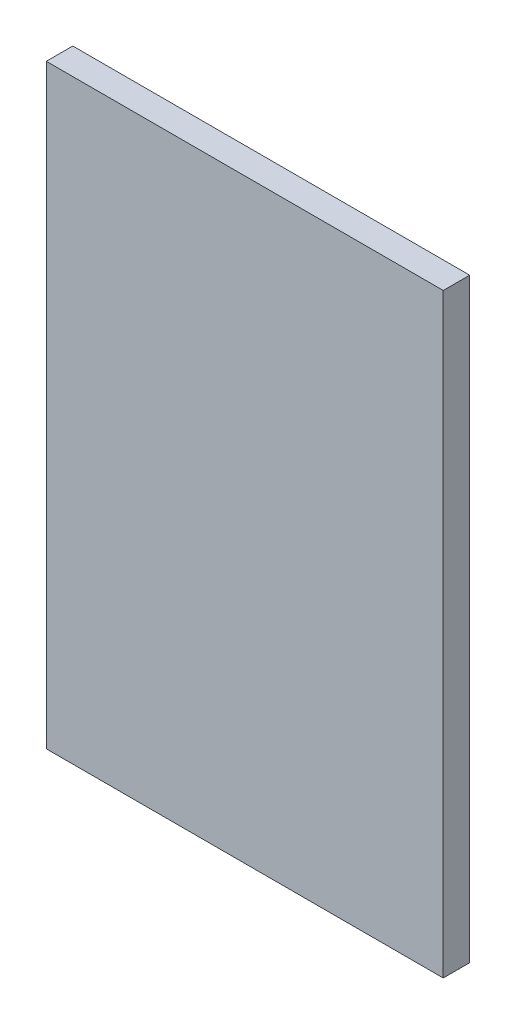
from build123d import *

# Parameters (mm, degrees)
CROQUIS1_W              = 150
CROQUIS1_H              = 225
SALIENTE_EXTRUIR1_DEPTH = 10


with BuildPart() as part:
    # Croquis1 → Saliente-Extruir1 (new body)
    with BuildSketch(Plane.XY):
        with Locations((75, 112.5)):
            Rectangle(CROQUIS1_W, CROQUIS1_H)
    extrude(amount=-SALIENTE_EXTRUIR1_DEPTH)


solid = part.part
